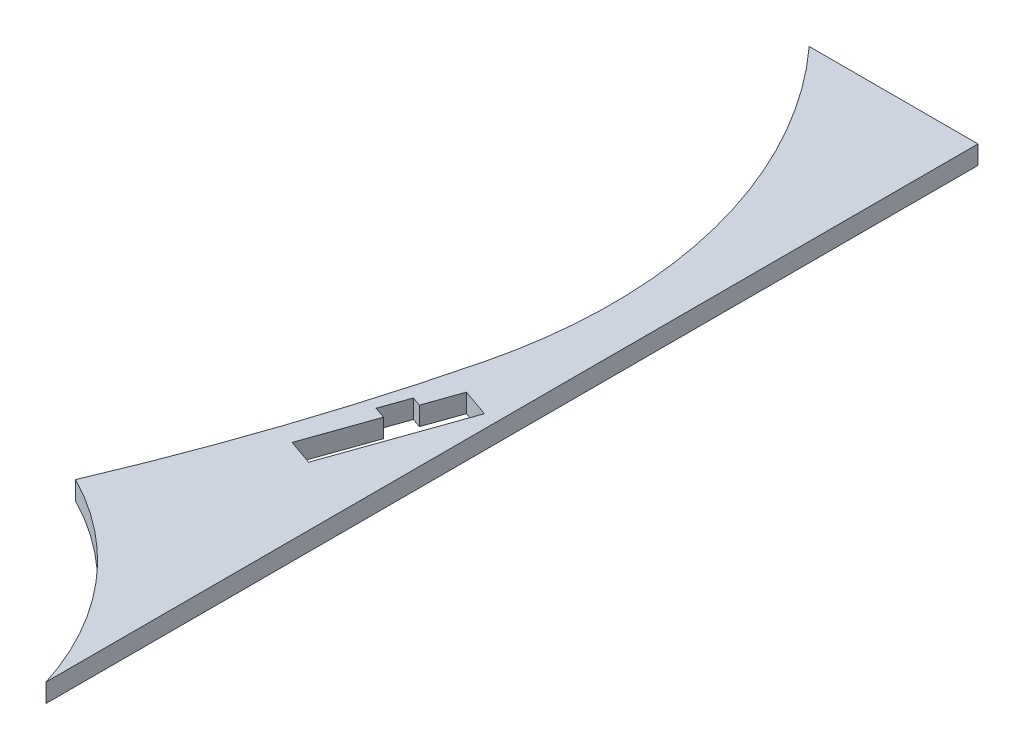
from build123d import *

# Parameters (mm, degrees)
BOSS_EXTRUDE1_DEPTH = 6.35
SKETCH3_W           = 19.05
SKETCH3_H           = 169.388632852
CUT_EXTRUDE3_DEPTH  = 327.660693329
CUT_EXTRUDE2_DEPTH  = 327.660693329


with BuildPart() as part:
    # Sketch1 → Boss-Extrude1 (new body)
    with BuildSketch(Plane(origin=(0, 0, 0), x_dir=(1, 0, 0), z_dir=(0, 1, 0))):
        with BuildLine():
            Line((0, 169.388632852), (0, 0))
            Line((0, 0), (-19.05, 0))
            ThreePointArc((-19.05, 0), (-39.88804557, 37.868270719), (-73.722410895, 64.765590165))
            ThreePointArc((-73.722410895, 64.765590165), (-54.193392954, 116.375662835), (-38.876501861, 169.388632852))
            ThreePointArc((-38.876501861, 169.388632852), (-39.194658591, 248.155900408), (-76.554791267, 317.5))
            Line((-76.554791267, 317.5), (-19.05, 317.5))
            Line((-19.05, 317.5), (-19.05, 169.388632852))
            Line((-19.05, 169.388632852), (0, 169.388632852))
        make_face()
    extrude(amount=BOSS_EXTRUDE1_DEPTH)

    # Sketch3 → Cut-Extrude3 (cut, through all)
    with BuildSketch(Plane(origin=(0, 6.35, 0), x_dir=(1, 0, 0), z_dir=(0, 1, 0))):
        with Locations((-9.525, 84.694316426)):
            Rectangle(SKETCH3_W, SKETCH3_H)
    extrude(amount=-CUT_EXTRUDE3_DEPTH, mode=Mode.SUBTRACT)

    # Sketch2 → Cut-Extrude2 (cut, through all)
    with BuildSketch(Plane(origin=(0, 6.35, 0), x_dir=(1, 0, 0), z_dir=(0, 1, 0))):
        Polygon((-39.164098049, 109.561842364), (-23.543572116, 153.825683885), (-32.944847981, 157.143355113), (-37.133143759, 145.274992843), (-40.27089443, 146.38229203), (-43.588565658, 136.981016166), (-39.696317688, 135.607458014), (-47.810876614, 112.613254626), align=None)
    extrude(amount=-CUT_EXTRUDE2_DEPTH, mode=Mode.SUBTRACT)


solid = part.part
